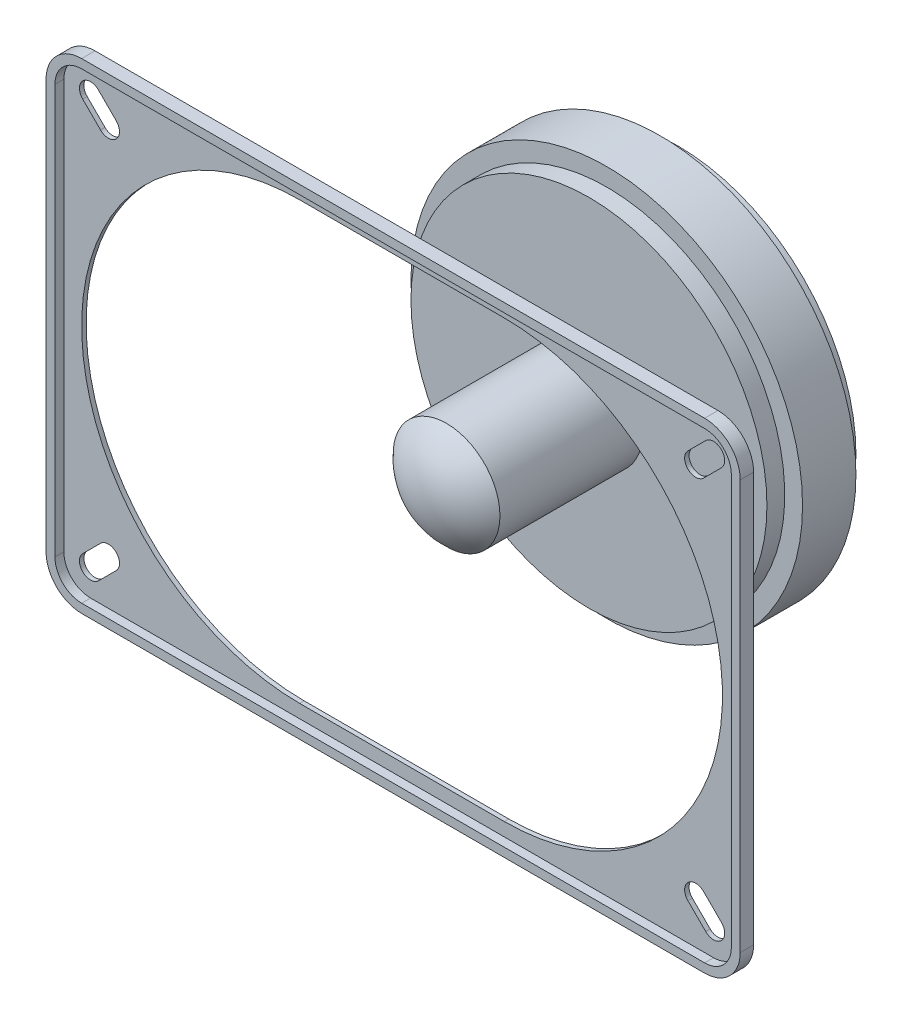
from build123d import *

# Parameters (mm, degrees)
SKETCH1_W           = 123.825
SKETCH1_H           = 85.725
BOSS_EXTRUDE1_DEPTH = 2.38125
FILLET1_R           = 6.35
CUT_EXTRUDE1_DEPTH  = 1.5875
CUT_EXTRUDE2_REACH  = 77.318
SKETCH6_R           = 31.75
BOSS_EXTRUDE2_DEPTH = 15.875
BOSS_EXTRUDE3_START = -3.175
SKETCH19_R          = 34.925
BOSS_EXTRUDE3_DEPTH = 9.525
CUT_EXTRUDE3_DEPTH  = 0.79375


with BuildPart() as part:
    # Sketch1 → Boss-Extrude1 (new body)
    with BuildSketch(Plane.XY):
        Rectangle(SKETCH1_W, SKETCH1_H)
    extrude(amount=BOSS_EXTRUDE1_DEPTH)

    # Fillet1
    fillet1_edges = [part.edges().sort_by_distance(p)[0] for p in [
        (61.9125, -42.8625, 1.190625),
        (-61.9125, -42.8625, 1.190625),
        (-61.9125, 42.8625, 1.190625),
        (61.9125, 42.8625, 1.190625),
    ]]
    fillet(fillet1_edges, radius=FILLET1_R)

    # Sketch2 → Cut-Extrude1 (cut)
    with BuildSketch(Plane.XY.offset(2.38125)):
        with BuildLine():
            Line((-60.325, 36.5125), (-60.325, -36.5125))
            ThreePointArc((-60.325, -36.5125), (-58.930096045, -39.880096045), (-55.5625, -41.275))
            Line((-55.5625, -41.275), (55.5625, -41.275))
            ThreePointArc((55.5625, -41.275), (58.930096045, -39.880096045), (60.325, -36.5125))
            Line((60.325, -36.5125), (60.325, 36.5125))
            ThreePointArc((60.325, 36.5125), (58.930096045, 39.880096045), (55.5625, 41.275))
            Line((55.5625, 41.275), (-55.5625, 41.275))
            ThreePointArc((-55.5625, 41.275), (-58.930096045, 39.880096045), (-60.325, 36.5125))
        make_face()
    extrude(amount=-CUT_EXTRUDE1_DEPTH, mode=Mode.SUBTRACT)

    # Sketch3 → Cut-Extrude2 (cut, up to next)
    with BuildSketch(Plane.XY.offset(0.79375), mode=Mode.PRIVATE) as cut_extrude2_sk1:
        with BuildLine():
            Line((-18.25625, 38.89375), (18.25625, 38.89375))
            ThreePointArc((18.25625, 38.89375), (57.15, 0), (18.25625, -38.89375))
            Line((18.25625, -38.89375), (-18.25625, -38.89375))
            ThreePointArc((-18.25625, -38.89375), (-57.15, 0), (-18.25625, 38.89375))
        make_face()
    cut_extrude2_tool1 = extrude(cut_extrude2_sk1.sketch, amount=-CUT_EXTRUDE2_REACH, mode=Mode.PRIVATE) & part.part
    add(cut_extrude2_tool1.solids().sort_by_distance((0, 0, 0.79375))[0], mode=Mode.SUBTRACT)

    # Sketch20 → Cut-Extrude3 (cut)
    with BuildSketch(Plane.XY.offset(0.79375)):
        with BuildLine():
            Line((-54.159334981, 37.915665019), (-50.984334981, 34.740665019))
            ThreePointArc((-50.984334981, 34.740665019), (-50.984334981, 31.934334981), (-53.790665019, 31.934334981))
            Line((-53.790665019, 31.934334981), (-56.965665019, 35.109334981))
            ThreePointArc((-56.965665019, 35.109334981), (-56.965665019, 37.915665019), (-54.159334981, 37.915665019))
        make_face()
        with BuildLine():
            Line((54.159334981, 37.915665019), (50.984334981, 34.740665019))
            ThreePointArc((50.984334981, 34.740665019), (50.984334981, 31.934334981), (53.790665019, 31.934334981))
            Line((53.790665019, 31.934334981), (56.965665019, 35.109334981))
            ThreePointArc((56.965665019, 35.109334981), (56.965665019, 37.915665019), (54.159334981, 37.915665019))
        make_face()
        with BuildLine():
            Line((-54.159334981, -37.915665019), (-50.984334981, -34.740665019))
            ThreePointArc((-50.984334981, -34.740665019), (-50.984334981, -31.934334981), (-53.790665019, -31.934334981))
            Line((-53.790665019, -31.934334981), (-56.965665019, -35.109334981))
            ThreePointArc((-56.965665019, -35.109334981), (-56.965665019, -37.915665019), (-54.159334981, -37.915665019))
        make_face()
        with BuildLine():
            Line((54.159334981, -37.915665019), (50.984334981, -34.740665019))
            ThreePointArc((50.984334981, -34.740665019), (50.984334981, -31.934334981), (53.790665019, -31.934334981))
            Line((53.790665019, -31.934334981), (56.965665019, -35.109334981))
            ThreePointArc((56.965665019, -35.109334981), (56.965665019, -37.915665019), (54.159334981, -37.915665019))
        make_face()
    extrude(amount=-CUT_EXTRUDE3_DEPTH, mode=Mode.SUBTRACT)


with BuildPart() as body_2:
    # Sketch5 → Revolve1 (revolve)
    with BuildSketch(Plane(origin=(0, 0, 0), x_dir=(0, 0, -1), z_dir=(1, 0, 0))):
        with BuildLine():
            Line((48.41875, 0), (48.41875, 9.525))
            Line((48.41875, 9.525), (7.14375, 9.525))
            ThreePointArc((7.14375, 9.525), (3.96875, 5.225260413), (2.844010413, 0))
            Line((2.844010413, 0), (48.41875, 0))
        make_face()
    revolve(axis=Axis((0, 0, 0), (0, 0, -1)))

    # Sketch6 → Boss-Extrude2 (add)
    with BuildSketch(Plane.XY.offset(-48.41875)):
        Circle(SKETCH6_R)
    extrude(amount=BOSS_EXTRUDE2_DEPTH)

    # Sketch19 → Boss-Extrude3 (add)
    with BuildSketch(Plane(origin=(0, 0, -48.41875), x_dir=(-1, 0, 0), z_dir=(0, 0, -1)).offset(BOSS_EXTRUDE3_START)):
        Circle(SKETCH19_R)
    extrude(amount=-BOSS_EXTRUDE3_DEPTH)


solid = Compound([part.part, body_2.part])
